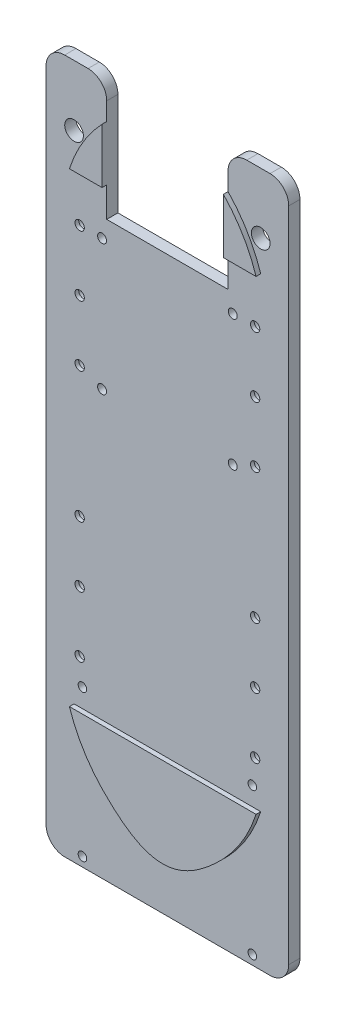
from build123d import *

# Parameters (mm, degrees)
SKETCH_1_W                     = 130
SKETCH_1_H                     = 347
EXTRUDE_1_DEPTH                = 6
EXTRUDE_2_DEPTH                = 2.5
SKETCH_3_W                     = 65
SKETCH_3_H                     = 65
CUT_EXTRUDE_1_DEPTH            = 371.600863592
EXTRUDE_3_DEPTH                = 2.5
EXTRUDE_4_DEPTH                = 2.5
HOLE_WIZARD_10_0_10_1_D        = 10
HOLE_WIZARD_4_8_4_8_1_D        = 4.8
HOLE_WIZARD_1_D                = 5
HOLE_WIZARD_1_DEPTH            = 8.5
HOLE_WIZARD_1_CBORE_D          = 7.2
HOLE_WIZARD_1_CBORE_DEPTH      = 4
FILLET_1_R                     = 10
SKETCH_14_W                    = 130
SKETCH_14_H                    = 6
EXTRUDE_5_DEPTH                = 25
HOLE_WIZARD_M2_5_1_D           = 3
HOLE_WIZARD_M2_5_1_CBORE_D     = 4.6
HOLE_WIZARD_M2_5_1_CBORE_DEPTH = 3.5
FILLET_2_R                     = 10


with BuildPart() as part:
    # 草图1 → 凸台-拉伸1 (new body)
    with BuildSketch(Plane(origin=(0, 0, 0), x_dir=(-1, 0, 0), z_dir=(0, 0, -1))):
        with Locations((-65, -173.5)):
            Rectangle(SKETCH_1_W, SKETCH_1_H)
    extrude(amount=-EXTRUDE_1_DEPTH)

    # 草图2 → 凸台-拉伸2 (add)
    with BuildSketch(Plane.XY.offset(6)):
        with BuildLine():
            Line((15, -298.5), (115, -298.5))
            ThreePointArc((115, -298.5), (107.915907861, -314.190105481), (97.5, -327.896769368))
            add(Edge.make_bspline(
                [(32.5, -327.896769368), (55.796929517, -351.885684413), (72.679914197, -353.454082804), (97.5, -327.896769368)],
                knots=[0, 0, 0, 0, 1, 1, 1, 1], degree=3))
            ThreePointArc((32.5, -327.896769368), (22.092962751, -314.184824775), (15, -298.5))
        make_face()
    extrude(amount=EXTRUDE_2_DEPTH)

    # 草图3 → 切除-拉伸1 (cut, through all)
    with BuildSketch(Plane.XY.offset(6)):
        with Locations((65, -32.5)):
            Rectangle(SKETCH_3_W, SKETCH_3_H)
    extrude(amount=-CUT_EXTRUDE_1_DEPTH, mode=Mode.SUBTRACT)

    # 草图4 → 凸台-拉伸3 (add)
    with BuildSketch(Plane.XY.offset(6)):
        with BuildLine():
            Line((115, -49), (97.5, -49))
            Line((97.5, -49), (97.5, -19.603230632))
            ThreePointArc((97.5, -19.603230632), (107.915907861, -33.309894519), (115, -49))
        make_face()
    extrude(amount=EXTRUDE_3_DEPTH)

    # 草图5 → 凸台-拉伸4 (add)
    with BuildSketch(Plane.XY.offset(6)):
        with BuildLine():
            Line((32.5, -19.603230632), (32.5, -49))
            Line((32.5, -49), (15, -49))
            ThreePointArc((15, -49), (22.092962751, -33.315175225), (32.5, -19.603230632))
        make_face()
    extrude(amount=EXTRUDE_4_DEPTH)

    # Ø10.0 (10) 直径孔1 (through all)
    with Locations(Plane.XY.offset(6)):
        with Locations((15, -32.5), (115, -32.5)):
            Hole(HOLE_WIZARD_10_0_10_1_D / 2)

    # Ø4.8 (4.8) 直径孔1 (through all)
    with Locations(Plane.XY.offset(6)):
        with Locations((100, -75), (30, -145), (100, -145), (30, -75)):
            Hole(HOLE_WIZARD_4_8_4_8_1_D / 2)

    # 孔1
    with Locations(Plane(origin=(0, 0, 0), x_dir=(-1, 0, 0), z_dir=(0, 0, -1))):
        with Locations((-18, -75), (-112, -210), (-112, -140), (-112, -107.5), (-18, -107.5), (-18, -140), (-18, -210), (-18, -242.5), (-18, -275), (-112, -275), (-112, -242.5), (-112, -75)):
            CounterBoreHole(HOLE_WIZARD_1_D / 2, HOLE_WIZARD_1_CBORE_D / 2, HOLE_WIZARD_1_CBORE_DEPTH, depth=HOLE_WIZARD_1_DEPTH)

    # 圆角1
    fillet_1_edges = [part.edges().sort_by_distance(p)[0] for p in [
        (97.5, 0, 3),
        (32.5, 0, 3),
        (130, 0, 3),
        (0, 0, 3),
    ]]
    fillet(fillet_1_edges, radius=FILLET_1_R)

    # 草图14 → 凸台-拉伸5 (add)
    with BuildSketch(Plane.XZ.offset(347)):
        with Locations((65, 3)):
            Rectangle(SKETCH_14_W, SKETCH_14_H)
    extrude(amount=EXTRUDE_5_DEPTH)

    # M2.5 六角头机械螺钉的柱形沉头孔1 (through all)
    with Locations(Plane.XY.offset(6)):
        with Locations((110.5, -288.5), (19.5, -288.5), (19.5, -367), (110.5, -367)):
            CounterBoreHole(HOLE_WIZARD_M2_5_1_D / 2, HOLE_WIZARD_M2_5_1_CBORE_D / 2, HOLE_WIZARD_M2_5_1_CBORE_DEPTH)

    # 圆角2
    fillet_2_edges = [part.edges().sort_by_distance(p)[0] for p in [
        (0, -372, 3),
        (130, -372, 3),
    ]]
    fillet(fillet_2_edges, radius=FILLET_2_R)


solid = part.part
